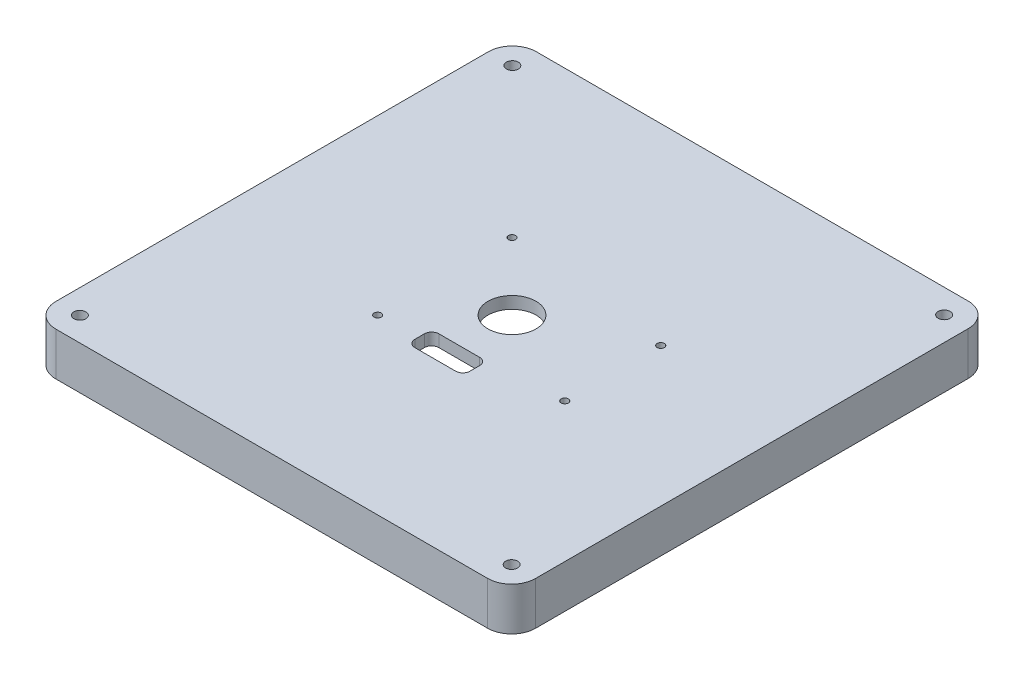
from build123d import *

# Parameters (mm, degrees)
SKETCH1_W           = 200
SKETCH1_H           = 200.3
BOSS_EXTRUDE1_DEPTH = 18
FILLET1_R           = 10
SKETCH2_W           = 150
SKETCH2_H           = 100
CUT_EXTRUDE1_DEPTH  = 13
FILLET2_R           = 10
SKETCH3_R           = 5
CUT_EXTRUDE2_DEPTH  = 5
SKETCH4_R           = 2.5
CUT_EXTRUDE3_DEPTH  = 143.123265161
SKETCH5_R           = 10
CUT_EXTRUDE4_DEPTH  = 143.123265161
SKETCH6_R           = 1.5
SKETCH6_W           = 23
SKETCH6_H           = 10
CUT_EXTRUDE5_DEPTH  = 143.667524335
FILLET3_R           = 3


with BuildPart() as part:
    # Sketch1 → Boss-Extrude1 (new body)
    with BuildSketch(Plane(origin=(0, 0, 0), x_dir=(1, 0, 0), z_dir=(0, 1, 0))):
        Rectangle(SKETCH1_W, SKETCH1_H)
    extrude(amount=BOSS_EXTRUDE1_DEPTH)

    # Fillet1
    fillet1_edges = [part.edges().sort_by_distance(p)[0] for p in [
        (100, 9, 100.15),
        (-100, 9, 100.15),
        (-100, 9, -100.15),
        (100, 9, -100.15),
    ]]
    fillet(fillet1_edges, radius=FILLET1_R)

    # Sketch2 → Cut-Extrude1 (cut)
    with BuildSketch(Plane.XZ):
        Rectangle(SKETCH2_W, SKETCH2_H)
    extrude(amount=-CUT_EXTRUDE1_DEPTH, mode=Mode.SUBTRACT)

    # Fillet2
    fillet2_edges = [part.edges().sort_by_distance(p)[0] for p in [
        (75, 6.5, 50),
        (75, 6.5, -50),
        (-75, 6.5, -50),
        (-75, 6.5, 50),
    ]]
    fillet(fillet2_edges, radius=FILLET2_R)

    # Sketch3 → Cut-Extrude2 (cut)
    with BuildSketch(Plane.XZ):
        with Locations(Location((-90, 90.15, 0), (0, 0, 270))):
            Circle(SKETCH3_R)
        with Locations(Location((90, 90.15, 0), (0, 0, 270))):
            Circle(SKETCH3_R)
        with Locations(Location((90, -90.15, 0), (0, 0, 270))):
            Circle(SKETCH3_R)
        with Locations(Location((-90, -90.15, 0), (0, 0, 270))):
            Circle(SKETCH3_R)
    extrude(amount=-CUT_EXTRUDE2_DEPTH, mode=Mode.SUBTRACT)

    # Sketch4 → Cut-Extrude3 (cut, through all)
    with BuildSketch(Plane.XZ.offset(-5)):
        with Locations(Location((-90, 90.15, 0), (0, 0, 270))):
            Circle(SKETCH4_R)
        with Locations(Location((90, 90.15, 0), (0, 0, 270))):
            Circle(SKETCH4_R)
        with Locations(Location((90, -90.15, 0), (0, 0, 270))):
            Circle(SKETCH4_R)
        with Locations(Location((-90, -90.15, 0), (0, 0, 270))):
            Circle(SKETCH4_R)
    extrude(amount=-CUT_EXTRUDE3_DEPTH, mode=Mode.SUBTRACT)

    # Sketch5 → Cut-Extrude4 (cut, through all)
    with BuildSketch(Plane.XZ.offset(-13)):
        with Locations(Location((0, 0, 0), (0, 0, 270))):
            Circle(SKETCH5_R)
    extrude(amount=-CUT_EXTRUDE4_DEPTH, mode=Mode.SUBTRACT)

    # Sketch6 → Cut-Extrude5 (cut, through all)
    with BuildSketch(Plane(origin=(0, 18, 0), x_dir=(1, 0, 0), z_dir=(0, 1, 0))):
        with Locations(Location((-28, -28, 0), (0, 0, 270))):
            Circle(SKETCH6_R)
        with Locations(Location((42, -20, 0), (0, 0, 270))):
            Circle(SKETCH6_R)
        with Locations(Location((-28, 28, 0), (0, 0, 90))):
            Circle(SKETCH6_R)
        with Locations(Location((42, 20, 0), (0, 0, 90))):
            Circle(SKETCH6_R)
        with Locations((0, -27)):
            Rectangle(SKETCH6_W, SKETCH6_H)
    extrude(amount=-CUT_EXTRUDE5_DEPTH, mode=Mode.SUBTRACT)

    # Fillet3
    fillet3_edges = [part.edges().sort_by_distance(p)[0] for p in [
        (11.5, 15.5, 22),
        (11.5, 15.5, 32),
        (-11.5, 15.5, 32),
        (-11.5, 15.5, 22),
    ]]
    fillet(fillet3_edges, radius=FILLET3_R)


solid = part.part
